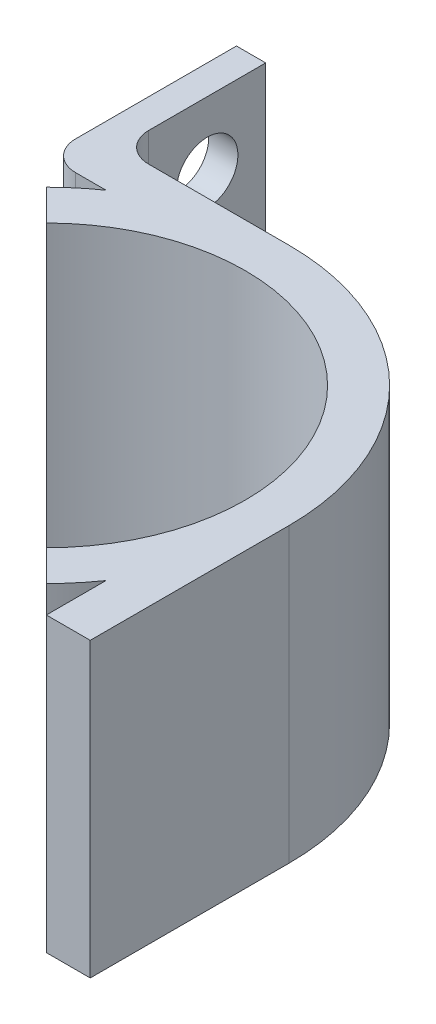
from build123d import *

# Parameters (mm, degrees)
EXTRUDE_2_DEPTH     = 20
SKETCH_2_W          = 2
SKETCH_2_H          = 10
EXTRUDE_3_DEPTH     = 20
FILLET_1_R          = 2
SKETCH_3_R          = 2.1
CUT_EXTRUDE_1_DEPTH = 20
FILLET_2_R          = 2


with BuildPart() as part:
    # 草图1 → 凸台-拉伸2 (new body)
    with BuildSketch(Plane(origin=(0, 0, 0), x_dir=(1, 0, 0), z_dir=(0, 1, 0))):
        with BuildLine():
            ThreePointArc((0, -20.77807044), (-4.862027432, -9.040097872), (-16.6, -4.17807044))
            Line((-16.6, -4.17807044), (-30.2, -4.17807044))
            Line((-30.2, -4.17807044), (-30.2, -7.17807044))
            Line((-30.2, -7.17807044), (-26.118403227, -7.17807044))
            ThreePointArc((-26.118403227, -7.17807044), (-27.268887689, -8.060569291), (-28.337972568, -9.040097872))
            Line((-28.337972568, -9.040097872), (-26.216652224, -11.161418216))
            ThreePointArc((-26.216652224, -11.161418216), (-25.340775456, -10.358912872), (-24.398209873, -9.635901765))
            ThreePointArc((-24.398209873, -9.635901765), (-20.688184562, -7.807074064), (-16.6, -7.17807044))
            ThreePointArc((-16.6, -7.17807044), (-6.983347776, -11.161418216), (-3, -20.77807044))
            ThreePointArc((-3, -20.77807044), (-3.629003624, -24.866255002), (-5.457831325, -28.576280313))
            ThreePointArc((-5.457831325, -28.576280313), (-6.180842432, -29.518845896), (-6.983347776, -30.394722664))
            Line((-6.983347776, -30.394722664), (-4.862027432, -32.516043007))
            ThreePointArc((-4.862027432, -32.516043007), (-3.882498851, -31.446958129), (-3, -30.296473667))
            Line((-3, -30.296473667), (-3, -34.37807044))
            Line((-3, -34.37807044), (0, -34.37807044))
            Line((0, -34.37807044), (0, -20.77807044))
        make_face()
    extrude(amount=EXTRUDE_2_DEPTH)

    # 草图2 → 凸台-拉伸3 (add)
    with BuildSketch(Plane(origin=(0, 20, 0), x_dir=(1, 0, 0), z_dir=(0, 1, 0))):
        with Locations((-29.2, 0.82192956)):
            Rectangle(SKETCH_2_W, SKETCH_2_H)
    extrude(amount=-EXTRUDE_3_DEPTH)

    # 圆角1
    fillet_1_edges = [part.edges().sort_by_distance(p)[0] for p in [
        (-28.2, 10, 4.17807044),
    ]]
    fillet(fillet_1_edges, radius=FILLET_1_R)

    # 草图3 → 切除-拉伸1 (cut)
    with BuildSketch(Plane(origin=(-28.2, 0, 0), x_dir=(0, 0, -1), z_dir=(1, 0, 0))):
        with Locations((1.82192956, 15.5)):
            Circle(SKETCH_3_R)
        with Locations((1.82192956, 4.5)):
            Circle(SKETCH_3_R)
    extrude(amount=-CUT_EXTRUDE_1_DEPTH, mode=Mode.SUBTRACT)

    # 圆角2
    fillet_2_edges = [part.edges().sort_by_distance(p)[0] for p in [
        (-30.2, 10, 7.17807044),
    ]]
    fillet(fillet_2_edges, radius=FILLET_2_R)


solid = part.part
